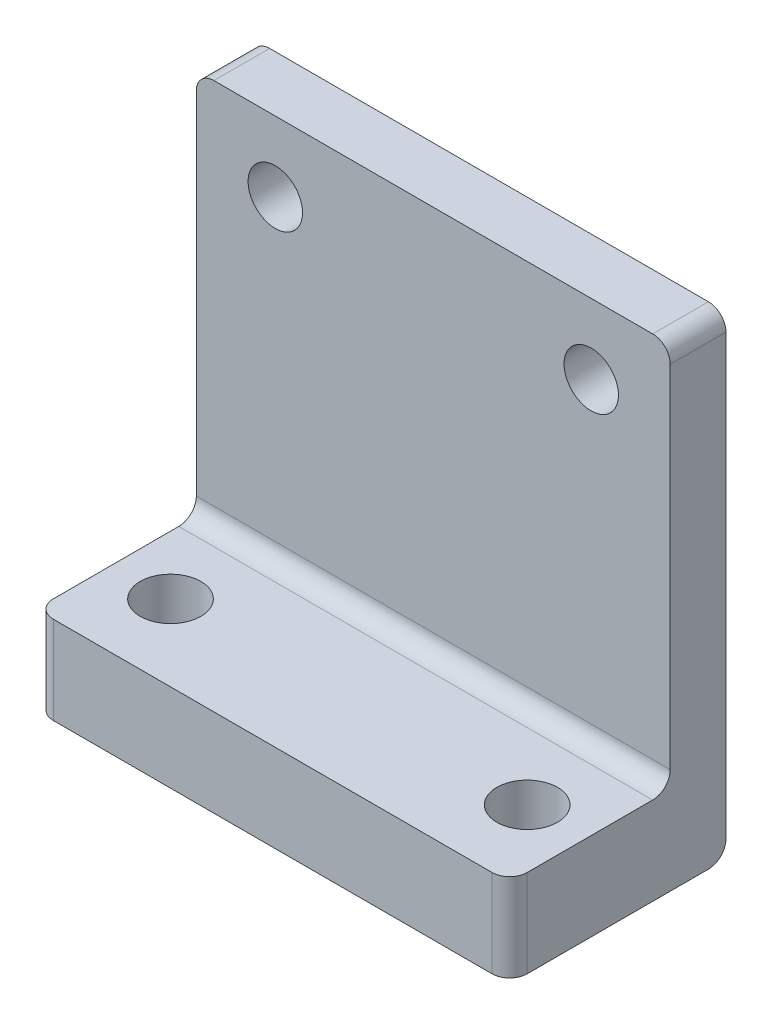
from build123d import *

# Parameters (mm, degrees)
SKETCH1_W             = 27
SKETCH1_H             = 20
SKETCH1_R             = 1.55
SKETCH1_H_2           = 5
SKETCH1_H_3           = 2
BOSS_EXTRUDE1_DEPTH   = 3.175
BOSS_EXTRUDE2_START   = 3.175
SKETCH1_3_W           = 27
SKETCH1_3_H           = 5
BOSS_EXTRUDE2_DEPTH   = 9.15
F_8_32_TAPPED_HOLE1_D = 3.4544
FILLET1_R             = 1


with BuildPart() as part:
    # Sketch1 → Boss-Extrude1 (new body)
    # profile 1 of 3: a face of its own
    with BuildSketch(Plane.XY):
        with Locations((13.5, -10)):
            Rectangle(SKETCH1_W, SKETCH1_H)
        with Locations((4.5, -2)):
            Circle(SKETCH1_R, mode=Mode.SUBTRACT)
        with Locations((22.5, -2)):
            Circle(SKETCH1_R, mode=Mode.SUBTRACT)
    # profile 2 of 3: a face of its own
    with BuildSketch(Plane.XY):
        with Locations((13.5, -22.5)):
            Rectangle(SKETCH1_W, SKETCH1_H_2)
    # profile 3 of 3: a face of its own
    with BuildSketch(Plane.XY):
        with Locations((13.5, 1)):
            Rectangle(SKETCH1_W, SKETCH1_H_3)
    extrude(amount=BOSS_EXTRUDE1_DEPTH)

    # Sketch1<3> → Boss-Extrude2 (add)
    with BuildSketch(Plane.XY.offset(BOSS_EXTRUDE2_START)):
        with Locations((13.5, -22.5)):
            Rectangle(SKETCH1_3_W, SKETCH1_3_H)
    extrude(amount=BOSS_EXTRUDE2_DEPTH)

    # #8-32 Tapped Hole1 (through all)
    with Locations(Plane(origin=(3.34, -20, 7.985), x_dir=(0, 0, 1), z_dir=(0, 1, 0))):
        with Locations((0, 0), (0, 20.32)):
            Hole(F_8_32_TAPPED_HOLE1_D / 2)

    # Fillet1
    fillet1_edges = [part.edges().sort_by_distance(p)[0] for p in [
        (0, 2, 1.5875),
        (27, 2, 1.5875),
        (0, -22.5, 12.325),
        (13.5, -20, 3.175),
        (27, -22.5, 12.325),
        (13.5, -25, 0),
    ]]
    fillet(fillet1_edges, radius=FILLET1_R)


solid = part.part
